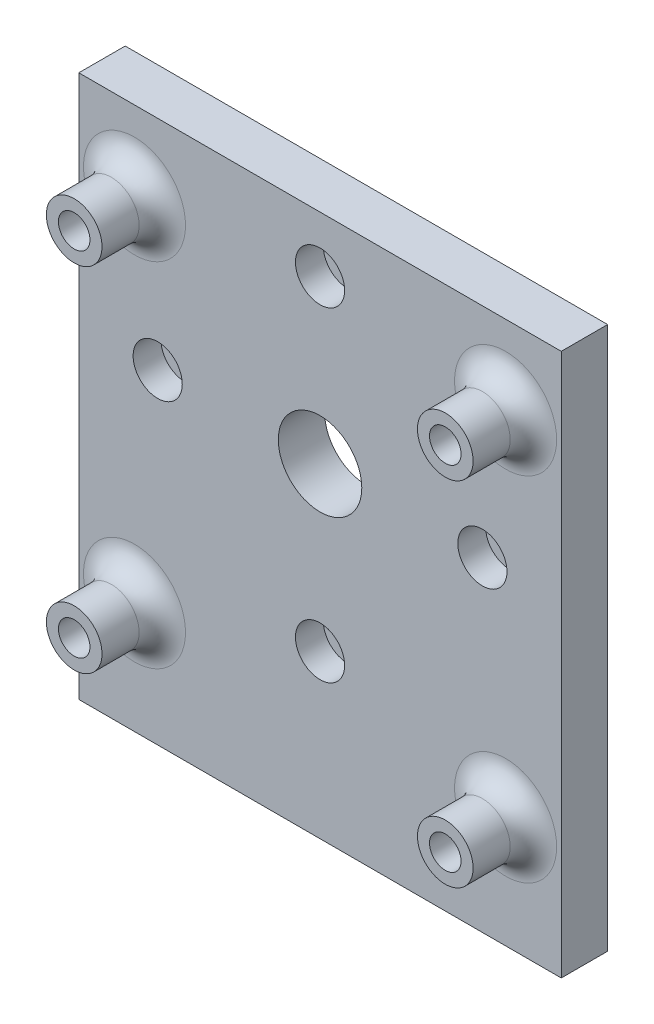
from build123d import *

# Parameters (mm, degrees)
SKETCH2_W               = 52
SKETCH2_H               = 58.5
SKETCH2_R               = 1.7
SKETCH2_R_2             = 2.65
BOSS_EXTRUDE1_DEPTH     = 5
SKETCH2_3_R             = 2.65
SKETCH2_3_R_2           = 1.5
BOSS_EXTRUDE2_DEPTH     = 2
SKETCH3_R               = 3
SKETCH3_R_2             = 1.7
BOSS_EXTRUDE3_DEPTH     = 6.5
CUT_EXTRUDE1_DEPTH      = 45.082309377
CUT_EXTRUDE1_DEPTH_BACK = 45.082309377
SKETCH4_R               = 4.5
FILLET1_R               = 2.5


with BuildPart() as part:
    # Sketch2 → Boss-Extrude1 (new body)
    with BuildSketch(Plane.XY):
        with Locations((0, -5.75)):
            Rectangle(SKETCH2_W, SKETCH2_H)
        with Locations((-20, -23)):
            Circle(SKETCH2_R, mode=Mode.SUBTRACT)
        with Locations((20, -23)):
            Circle(SKETCH2_R, mode=Mode.SUBTRACT)
        with Locations((0, -17.5)):
            Circle(SKETCH2_R_2, mode=Mode.SUBTRACT)
        with Locations((-17.5, 0)):
            Circle(SKETCH2_R_2, mode=Mode.SUBTRACT)
        with Locations((-20, 15)):
            Circle(SKETCH2_R, mode=Mode.SUBTRACT)
        with Locations((17.5, 0)):
            Circle(SKETCH2_R_2, mode=Mode.SUBTRACT)
        with Locations((0, 17.5)):
            Circle(SKETCH2_R_2, mode=Mode.SUBTRACT)
        with Locations((20, 15)):
            Circle(SKETCH2_R, mode=Mode.SUBTRACT)
    extrude(amount=BOSS_EXTRUDE1_DEPTH)

    # Sketch2<3> → Boss-Extrude2 (add)
    # profile 1 of 4: a face of its own
    with BuildSketch(Plane.XY):
        with Locations((0, 17.5)):
            Circle(SKETCH2_3_R)
        with Locations((0, 17.5)):
            Circle(SKETCH2_3_R_2, mode=Mode.SUBTRACT)
    # profile 2 of 4: a face of its own
    with BuildSketch(Plane.XY):
        with Locations((17.5, 0)):
            Circle(SKETCH2_3_R)
        with Locations((17.5, 0)):
            Circle(SKETCH2_3_R_2, mode=Mode.SUBTRACT)
    # profile 3 of 4: a face of its own
    with BuildSketch(Plane.XY):
        with Locations((0, -17.5)):
            Circle(SKETCH2_3_R)
        with Locations((0, -17.5)):
            Circle(SKETCH2_3_R_2, mode=Mode.SUBTRACT)
    # profile 4 of 4: a face of its own
    with BuildSketch(Plane.XY):
        with Locations((-17.5, 0)):
            Circle(SKETCH2_3_R)
        with Locations((-17.5, 0)):
            Circle(SKETCH2_3_R_2, mode=Mode.SUBTRACT)
    extrude(amount=BOSS_EXTRUDE2_DEPTH)

    # Sketch3 → Boss-Extrude3 (add)
    # profile 1 of 4: a face of its own
    with BuildSketch(Plane.XY.offset(5)):
        with Locations((-20, 15)):
            Circle(SKETCH3_R)
        with Locations((-20, 15)):
            Circle(SKETCH3_R_2, mode=Mode.SUBTRACT)
    # profile 2 of 4: a face of its own
    with BuildSketch(Plane.XY.offset(5)):
        with Locations((20, 15)):
            Circle(SKETCH3_R)
        with Locations((20, 15)):
            Circle(SKETCH3_R_2, mode=Mode.SUBTRACT)
    # profile 3 of 4: a face of its own
    with BuildSketch(Plane.XY.offset(5)):
        with Locations((-20, -23)):
            Circle(SKETCH3_R)
        with Locations((-20, -23)):
            Circle(SKETCH3_R_2, mode=Mode.SUBTRACT)
    # profile 4 of 4: a face of its own
    with BuildSketch(Plane.XY.offset(5)):
        with Locations((20, -23)):
            Circle(SKETCH3_R)
        with Locations((20, -23)):
            Circle(SKETCH3_R_2, mode=Mode.SUBTRACT)
    extrude(amount=BOSS_EXTRUDE3_DEPTH)

    # Sketch4 → Cut-Extrude1 (cut, two sides: drawn at the far end of the back side and taken through both)
    with BuildSketch(Plane.XY.offset(5).offset(-CUT_EXTRUDE1_DEPTH_BACK)):
        Circle(SKETCH4_R)
    extrude(amount=CUT_EXTRUDE1_DEPTH + CUT_EXTRUDE1_DEPTH_BACK, mode=Mode.SUBTRACT)

    # Fillet1
    fillet1_edges = [part.edges().sort_by_distance(p)[0] for p in [
        (17, -23, 5),
        (-23, -23, 5),
        (17, 15, 5),
        (-23, 15, 5),
    ]]
    fillet(fillet1_edges, radius=FILLET1_R)


solid = part.part
